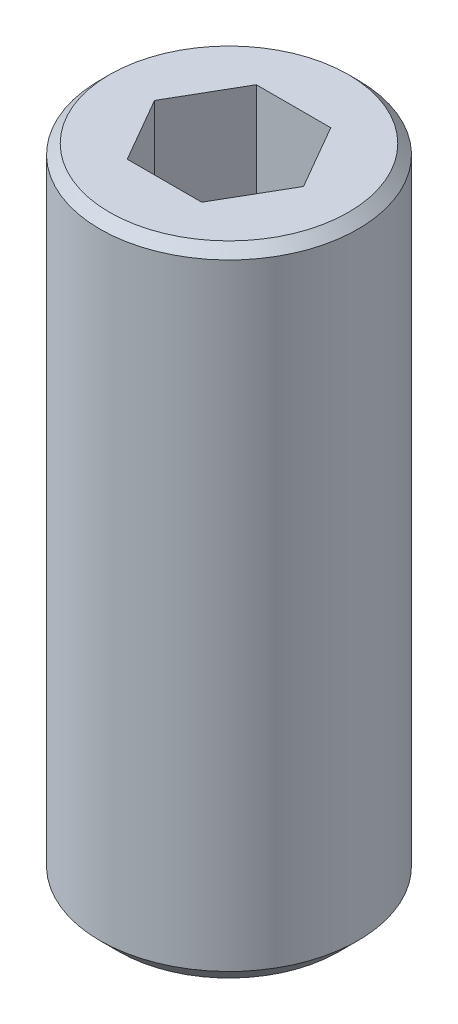
from build123d import *

# Parameters (mm, degrees)
CROQUIS1_W            = 2
CROQUIS1_H            = 10
CORTAR_EXTRUIR2_DEPTH = 2
CHAFL_N3_SIZE         = 0.3
CHAFL_N4_SIZE         = 0.15


with BuildPart() as part:
    # Croquis1 → Revolución1 (revolve)
    with BuildSketch(Plane.XY, mode=Mode.PRIVATE) as revoluci_n1_sk:
        with Locations((1, -5)):
            Rectangle(CROQUIS1_W, CROQUIS1_H)
    revolve(revoluci_n1_sk.sketch.rotate(Axis((0, 0, 0), (0, -1, 0)), 90), axis=Axis((0, 0, 0), (0, -1, 0)))

    # Croquis3 → Cortar-Extruir2 (cut)
    with BuildSketch(Plane(origin=(0, 0, 0), x_dir=(1, 0, 0), z_dir=(0, 1, 0))):
        Polygon((-0.577350269, 1), (-1.154700538, 0), (-0.577350269, -1), (0.577350269, -1), (1.154700538, 0), (0.577350269, 1), align=None)
    extrude(amount=-CORTAR_EXTRUIR2_DEPTH, mode=Mode.SUBTRACT)

    # Chaflán3
    chafl_n3_edges = [part.edges().sort_by_distance(p)[0] for p in [
        (0, -10, -2),
    ]]
    chamfer(chafl_n3_edges, length=CHAFL_N3_SIZE)

    # Chaflán4
    chafl_n4_edges = [part.edges().sort_by_distance(p)[0] for p in [
        (0, 0, -2),
    ]]
    chamfer(chafl_n4_edges, length=CHAFL_N4_SIZE)


solid = part.part
